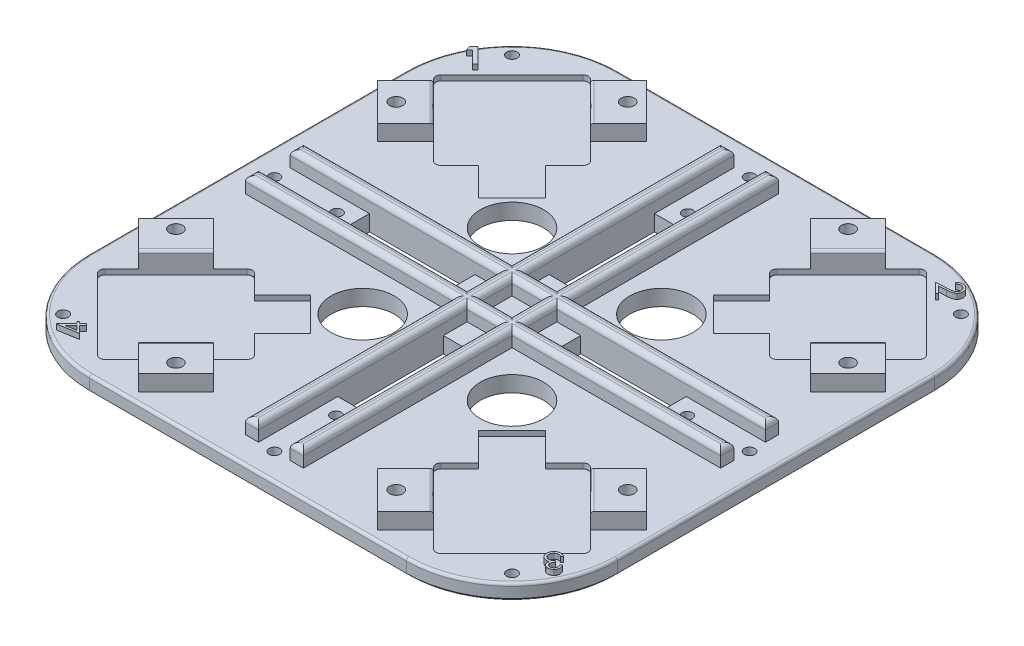
from build123d import *

# Parameters (mm, degrees)
SKETCH_1_W          = 200
SKETCH_1_H          = 200
SKETCH_1_R          = 2
EXTRUDE_1_DEPTH     = 6
CUT_EXTRUDE_1_DEPTH = 2
FILLET_1_R          = 2
EXTRUDE_3_DEPTH     = 6
FILLET_4_R          = 40
SKETCH_4_R          = 2.5
CUT_EXTRUDE_2_DEPTH = 8
SKETCH_5_W          = 5
SKETCH_5_H          = 180
EXTRUDE_4_DEPTH     = 6
SKETCH_6_W          = 180
SKETCH_6_H          = 5
EXTRUDE_5_DEPTH     = 6
FILLET_5_R          = 2
SKETCH_7_R          = 12
SKETCH_7_W          = 40
SKETCH_7_H          = 12
SKETCH_7_W_2        = 12
SKETCH_7_H_2        = 40
CUT_EXTRUDE_3_DEPTH = 6
CUT_EXTRUDE_4_DEPTH = 2
FILLET_6_R          = 1
SKETCH_9_R          = 2
CUT_EXTRUDE_5_DEPTH = 10
EXTRUDE_6_DEPTH     = 2
FILLET_9_R          = 1
CHAMFER_1_SIZE      = 1


with BuildPart() as part:
    # Эскиз1 → Бобышка-Вытянуть1 (new body)
    with BuildSketch(Plane(origin=(0, 0, 0), x_dir=(1, 0, 0), z_dir=(0, 1, 0))):
        Rectangle(SKETCH_1_W, SKETCH_1_H)
        with Locations(Location((-90, 0, 0), (0, 0, 270))):
            Circle(SKETCH_1_R, mode=Mode.SUBTRACT)
        with Locations(Location((0, 90, 0), (0, 0, 270))):
            Circle(SKETCH_1_R, mode=Mode.SUBTRACT)
        with Locations(Location((90, 0, 0), (0, 0, 270))):
            Circle(SKETCH_1_R, mode=Mode.SUBTRACT)
        with Locations(Location((0, -90, 0), (0, 0, 270))):
            Circle(SKETCH_1_R, mode=Mode.SUBTRACT)
        with Locations(Location((-85, 85, 0), (0, 0, 270))):
            Circle(SKETCH_1_R, mode=Mode.SUBTRACT)
        with Locations(Location((85, 85, 0), (0, 0, 270))):
            Circle(SKETCH_1_R, mode=Mode.SUBTRACT)
        with Locations(Location((85, -85, 0), (0, 0, 270))):
            Circle(SKETCH_1_R, mode=Mode.SUBTRACT)
        with Locations(Location((-85, -85, 0), (0, 0, 270))):
            Circle(SKETCH_1_R, mode=Mode.SUBTRACT)
    extrude(amount=EXTRUDE_1_DEPTH)

    # Эскиз2 → Вырез-Вытянуть1 (cut)
    with BuildSketch(Plane(origin=(0, 6, 0), x_dir=(1, 0, 0), z_dir=(0, 1, 0))):
        Polygon((63.639610307, 33.941125497), (33.941125497, 63.639610307), (63.639610307, 93.338095117), (93.338095117, 63.639610307), align=None)
        Polygon((33.941125497, -63.639610307), (63.639610307, -33.941125497), (93.338095117, -63.639610307), (63.639610307, -93.338095117), align=None)
        Polygon((-63.639610307, -33.941125497), (-33.941125497, -63.639610307), (-63.639610307, -93.338095117), (-93.338095117, -63.639610307), align=None)
        Polygon((-33.941125497, 63.639610307), (-63.639610307, 33.941125497), (-93.338095117, 63.639610307), (-63.639610307, 93.338095117), align=None)
    extrude(amount=-CUT_EXTRUDE_1_DEPTH, mode=Mode.SUBTRACT)

    # Скругление1
    fillet_1_edges = [part.edges().sort_by_distance(p)[0] for p in [
        (93.338095117, 5, -63.639610307),
        (63.639610307, 5, -33.941125497),
        (33.941125497, 5, -63.639610307),
        (63.639610307, 5, -93.338095117),
        (-93.338095117, 5, 63.639610307),
        (-63.639610307, 5, 33.941125497),
        (-33.941125497, 5, 63.639610307),
        (-63.639610307, 5, 93.338095117),
        (-63.639610307, 5, -93.338095117),
        (-33.941125497, 5, -63.639610307),
        (-63.639610307, 5, -33.941125497),
        (-93.338095117, 5, -63.639610307),
        (63.639610307, 5, 93.338095117),
        (33.941125497, 5, 63.639610307),
        (63.639610307, 5, 33.941125497),
        (93.338095117, 5, 63.639610307),
    ]]
    fillet(fillet_1_edges, radius=FILLET_1_R)

    # Эскиз3 → Бобышка-Вытянуть3 (add)
    with BuildSketch(Plane(origin=(0, 6, 0), x_dir=(1, 0, 0), z_dir=(0, 1, 0))):
        Polygon((41.71930009, 71.4177849), (55.861435714, 85.559920524), (45.254833996, 96.166522241), (31.112698372, 82.024386618), align=None)
        Polygon((85.559920524, 55.861435714), (96.166522241, 45.254833996), (82.024386618, 31.112698372), (71.4177849, 41.71930009), align=None)
        Polygon((71.4177849, -41.71930009), (85.559920524, -55.861435714), (96.166522241, -45.254833996), (82.024386618, -31.112698372), align=None)
        Polygon((31.112698372, -82.024386618), (45.254833996, -96.166522241), (55.861435714, -85.559920524), (41.71930009, -71.4177849), align=None)
        Polygon((-41.71930009, -71.4177849), (-55.861435714, -85.559920524), (-45.254833996, -96.166522241), (-31.112698372, -82.024386618), align=None)
        Polygon((-85.559920524, -55.861435714), (-96.166522241, -45.254833996), (-82.024386618, -31.112698372), (-71.4177849, -41.71930009), align=None)
        Polygon((-71.4177849, 41.71930009), (-85.559920524, 55.861435714), (-96.166522241, 45.254833996), (-82.024386618, 31.112698372), align=None)
        Polygon((-31.112698372, 82.024386618), (-45.254833996, 96.166522241), (-55.861435714, 85.559920524), (-41.71930009, 71.4177849), align=None)
    extrude(amount=EXTRUDE_3_DEPTH)

    # Скругление4
    fillet_4_edges = [part.edges().sort_by_distance(p)[0] for p in [
        (100, 3, 100),
        (-100, 3, 100),
        (-100, 3, -100),
        (100, 3, -100),
    ]]
    fillet(fillet_4_edges, radius=FILLET_4_R)

    # Эскиз4 → Вырез-Вытянуть2 (cut)
    with BuildSketch(Plane(origin=(0, 12, 0), x_dir=(1, 0, 0), z_dir=(0, 1, 0))):
        with Locations(Location((41.71930009, 85.559920524, 0), (0, 0, 270))):
            Circle(SKETCH_4_R)
        with Locations(Location((85.559920524, 41.71930009, 0), (0, 0, 90))):
            Circle(SKETCH_4_R)
        with Locations(Location((85.559920524, -41.71930009, 0), (0, 0, 270))):
            Circle(SKETCH_4_R)
        with Locations(Location((41.71930009, -85.559920524, 0), (0, 0, 90))):
            Circle(SKETCH_4_R)
        with Locations(Location((-41.71930009, -85.559920524, 0), (0, 0, 270))):
            Circle(SKETCH_4_R)
        with Locations(Location((-85.559920524, -41.71930009, 0), (0, 0, 90))):
            Circle(SKETCH_4_R)
        with Locations(Location((-85.559920524, 41.71930009, 0), (0, 0, 270))):
            Circle(SKETCH_4_R)
        with Locations(Location((-41.71930009, 85.559920524, 0), (0, 0, 90))):
            Circle(SKETCH_4_R)
    extrude(amount=-CUT_EXTRUDE_2_DEPTH, mode=Mode.SUBTRACT)

    # Эскиз5 → Бобышка-Вытянуть4 (add)
    with BuildSketch(Plane(origin=(0, 6, 0), x_dir=(1, 0, 0), z_dir=(0, 1, 0))):
        with Locations((-8.5, 0)):
            Rectangle(SKETCH_5_W, SKETCH_5_H)
        with Locations((8.5, 0)):
            Rectangle(SKETCH_5_W, SKETCH_5_H)
    extrude(amount=EXTRUDE_4_DEPTH)

    # Эскиз6 → Бобышка-Вытянуть5 (add)
    with BuildSketch(Plane(origin=(0, 6, 0), x_dir=(1, 0, 0), z_dir=(0, 1, 0))):
        with Locations((0, 8.5)):
            Rectangle(SKETCH_6_W, SKETCH_6_H)
        with Locations((0, -8.5)):
            Rectangle(SKETCH_6_W, SKETCH_6_H)
    extrude(amount=EXTRUDE_5_DEPTH)

    # Скругление5
    fillet_5_edges = [part.edges().sort_by_distance(p)[0] for p in [
        (11, 12, 50.5),
        (8.5, 12, -90),
        (6, 12, -50.5),
        (8.5, 12, 90),
        (-6, 12, 50.5),
        (-8.5, 12, -90),
        (-11, 12, -50.5),
        (-8.5, 12, 90),
        (-6, 12, -50.5),
        (-11, 12, 0),
        (11, 12, -50.5),
        (6, 12, 0),
        (50.5, 12, -6),
        (90, 12, -8.5),
        (50.5, 12, -11),
        (0, 12, -11),
        (0, 12, -6),
        (-50.5, 12, -11),
        (-90, 12, -8.5),
        (-50.5, 12, -6),
        (11, 12, 0),
        (-11, 12, 50.5),
        (-6, 12, 0),
        (6, 12, 50.5),
        (50.5, 12, 11),
        (90, 12, 8.5),
        (50.5, 12, 6),
        (0, 12, 6),
        (0, 12, 11),
        (-50.5, 12, 6),
        (-90, 12, 8.5),
        (-50.5, 12, 11),
    ]]
    fillet(fillet_5_edges, radius=FILLET_5_R)

    # Эскиз7 → Вырез-Вытянуть3 (cut)
    with BuildSketch(Plane(origin=(0, 6, 0), x_dir=(1, 0, 0), z_dir=(0, 1, 0))):
        with Locations(Location((28.284271247, 28.284271247, 0), (0, 0, 270))):
            Circle(SKETCH_7_R)
        with Locations(Location((28.284271247, -28.284271247, 0), (0, 0, 270))):
            Circle(SKETCH_7_R)
        with Locations(Location((-28.284271247, -28.284271247, 0), (0, 0, 270))):
            Circle(SKETCH_7_R)
        with Locations(Location((-28.284271247, 28.284271247, 0), (0, 0, 270))):
            Circle(SKETCH_7_R)
        with Locations((40, 0)):
            Rectangle(SKETCH_7_W, SKETCH_7_H)
        with Locations((0, 40)):
            Rectangle(SKETCH_7_W_2, SKETCH_7_H_2)
        with Locations((0, -40)):
            Rectangle(SKETCH_7_W_2, SKETCH_7_H_2)
        with Locations((-40, 0)):
            Rectangle(SKETCH_7_W, SKETCH_7_H)
    extrude(amount=-CUT_EXTRUDE_3_DEPTH, mode=Mode.SUBTRACT)

    # Эскиз8 → Вырез-Вытянуть4 (cut)
    with BuildSketch(Plane(origin=(0, 6, 0), x_dir=(1, 0, 0), z_dir=(0, 1, 0))):
        Polygon((44.547727215, 31.819805153), (31.819805153, 44.547727215), (53.033008589, 65.76093065), (65.76093065, 53.033008589), align=None)
        Polygon((65.76093065, -53.033008589), (53.033008589, -65.76093065), (31.819805153, -44.547727215), (44.547727215, -31.819805153), align=None)
        Polygon((-44.547727215, -31.819805153), (-31.819805153, -44.547727215), (-53.033008589, -65.76093065), (-65.76093065, -53.033008589), align=None)
        Polygon((-65.76093065, 53.033008589), (-53.033008589, 65.76093065), (-31.819805153, 44.547727215), (-44.547727215, 31.819805153), align=None)
    extrude(amount=-CUT_EXTRUDE_4_DEPTH, mode=Mode.SUBTRACT)

    # Скругление6
    fillet_6_edges = [part.edges().sort_by_distance(p)[0] for p in [
        (48.790367902, 12, -78.488852712),
        (78.488852712, 12, -48.790367902),
        (78.488852712, 12, 48.790367902),
        (48.790367902, 12, 78.488852712),
        (-48.790367902, 12, 78.488852712),
        (-78.488852712, 12, 48.790367902),
        (-78.488852712, 12, -48.790367902),
        (-48.790367902, 12, -78.488852712),
    ]]
    fillet(fillet_6_edges, radius=FILLET_6_R)

    # Эскиз9 → Вырез-Вытянуть5 (cut)
    with BuildSketch(Plane(origin=(0, 6, 0), x_dir=(1, 0, 0), z_dir=(0, 1, 0))):
        with Locations(Location((0.141931936, 66.467885895, 0), (0, 0, 270))):
            Circle(SKETCH_9_R)
        with Locations(Location((-0.141931936, -66.467885895, 0), (0, 0, 90))):
            Circle(SKETCH_9_R)
        with Locations(Location((66.467885895, -0.141931936, 0), (0, 0, 270))):
            Circle(SKETCH_9_R)
        with Locations(Location((-66.467885895, 0.141931936, 0), (0, 0, 90))):
            Circle(SKETCH_9_R)
    extrude(amount=-CUT_EXTRUDE_5_DEPTH, mode=Mode.SUBTRACT)

    # Эскиз10 → Бобышка-Вытянуть6 (add)
    # profile 1 of 4: a face of its own
    with BuildSketch(Plane(origin=(0, 6, 0), x_dir=(1, 0, 0), z_dir=(0, 1, 0))):
        Polygon((-93.750712904, 77.724103786), (-92.154559058, 79.320257633), (-86.555200084, 73.720898658), (-87.614494955, 72.661603786), (-92.212251366, 77.259360197), (-93.364494955, 76.107116607), align=None)
    # profile 2 of 4: a face of its own
    with BuildSketch(Plane(origin=(0, 6, 0), x_dir=(1, 0, 0), z_dir=(0, 1, 0))):
        with BuildLine():
            Line((76.0987496, 91.923727861), (75.555480369, 92.450971451))
            add(Edge.make_bspline(
                [(75.555480369, 92.450971451), (75.625456903, 92.516300702), (75.763171662, 92.644869547), (75.984477293, 92.813355888), (76.214418423, 92.955015815), (76.448941617, 93.07469718), (76.692130442, 93.166387315), (76.940996589, 93.234254207), (77.197732973, 93.276209775), (77.45859831, 93.291128509), (77.718971729, 93.284412395), (77.973089743, 93.249519834), (78.219528351, 93.19460855), (78.457011726, 93.111989621), (78.684788931, 93.003299851), (78.905866958, 92.873593769), (79.116948527, 92.717085838), (79.247247499, 92.596973846), (79.31349319, 92.535907348)],
                knots=[0, 0, 0, 0, 1.096707932, 2.158335985, 3.181104264, 4.188679101, 5.171089785, 6.15426324, 7.140633891, 8.146551945, 9.144952296, 10.120778538, 11.081683335, 12.034282701, 12.995557996, 13.969942767, 14.96789251, 16, 16, 16, 16], degree=3))
            add(Edge.make_bspline(
                [(79.31349319, 92.535907348), (79.376133617, 92.472382182), (79.498609197, 92.348176745), (79.658547196, 92.146504222), (79.790824979, 91.936920476), (79.904521546, 91.72360044), (79.986478784, 91.500269581), (80.048867911, 91.272157142), (80.084257123, 91.036558632), (80.092093621, 90.797626194), (80.082312183, 90.559888758), (80.047756573, 90.328865814), (79.995235457, 90.105968697), (79.921344241, 89.892191894), (79.826349966, 89.687563372), (79.710121516, 89.492869607), (79.5733703, 89.306937789), (79.467949379, 89.193054903), (79.414454728, 89.135266323)],
                knots=[0, 0, 0, 0, 1.126407395, 2.20237005, 3.243119692, 4.254155062, 5.249257611, 6.241152066, 7.237443563, 8.250413586, 9.256935383, 10.238887691, 11.196329578, 12.145940279, 13.090864483, 14.040954544, 15.005904593, 16, 16, 16, 16], degree=3))
            add(Edge.make_bspline(
                [(79.414454728, 89.135266323), (79.334585842, 89.058818614), (79.176248186, 88.907263341), (78.906415115, 88.719180831), (78.615917628, 88.565381577), (78.353842131, 88.467984262), (78.125691711, 88.404103173), (77.930771586, 88.361796151), (77.713080246, 88.323633899), (77.47308599, 88.288735255), (77.210164554, 88.257002101), (76.924386141, 88.2279042), (76.61605709, 88.204120186), (76.402728992, 88.192528989), (76.292659857, 88.186548374)],
                knots=[0, 0, 0, 0, 1.187168596, 2.353525883, 3.522425488, 4.712854112, 5.351061531, 6.068672607, 6.856146978, 7.726827361, 8.675672764, 9.70315713, 10.814916963, 12, 12, 12, 12], degree=3))
            Line((76.292659857, 88.186548374), (73.401634216, 88.035907348))
            Line((73.401634216, 88.035907348), (76.020223959, 85.489432989))
            Line((76.020223959, 85.489432989), (75.486570113, 84.941356066))
            Line((75.486570113, 84.941356066), (71.63400601, 88.688150938))
            Line((71.63400601, 88.688150938), (76.077916267, 88.922125297))
            add(Edge.make_bspline(
                [(76.077916267, 88.922125297), (76.185832846, 88.927808916), (76.393177431, 88.938729089), (76.691346693, 88.957508236), (76.964393647, 88.979706639), (77.211700451, 89.005468084), (77.433612602, 89.031997376), (77.62982603, 89.062218849), (77.800375067, 89.095416355), (77.992607262, 89.141452681), (78.208401553, 89.215326902), (78.444591375, 89.335219659), (78.663280187, 89.480628968), (78.788950071, 89.600706446), (78.851954728, 89.660907348)],
                knots=[0, 0, 0, 0, 1.321538564, 2.53912669, 3.653426717, 4.67135875, 5.579670898, 6.386254171, 7.09857628, 7.703820083, 8.802888551, 9.877991162, 10.936129829, 12, 12, 12, 12], degree=3))
            add(Edge.make_bspline(
                [(78.851954728, 89.660907348), (78.889138988, 89.701322038), (78.962090456, 89.780611259), (79.055799803, 89.910822514), (79.135318047, 90.047245104), (79.197039806, 90.191973943), (79.24570762, 90.34208732), (79.279824463, 90.498739105), (79.297163239, 90.662597596), (79.297995176, 90.831000903), (79.286084134, 91.000079946), (79.256992079, 91.164749987), (79.213640868, 91.323825712), (79.153811421, 91.476784477), (79.078739122, 91.623958095), (78.987516562, 91.764716311), (78.882126488, 91.900201752), (78.800486994, 91.982747798), (78.75900601, 92.0246894)],
                knots=[0, 0, 0, 0, 1.001176195, 1.964198688, 2.920391499, 3.876335942, 4.8286967, 5.795950982, 6.795798097, 7.828910882, 8.864915681, 9.883958, 10.874643394, 11.868248699, 12.875101078, 13.883461709, 14.924588032, 16, 16, 16, 16], degree=3))
            add(Edge.make_bspline(
                [(78.75900601, 92.0246894), (78.713819384, 92.066700287), (78.624711788, 92.149545356), (78.480125402, 92.256764299), (78.329782516, 92.347211025), (78.174710581, 92.422055278), (78.012581339, 92.475445096), (77.847303897, 92.516822784), (77.675820063, 92.539001355), (77.500266858, 92.543604068), (77.322031103, 92.530759223), (77.143930156, 92.499949054), (76.966131774, 92.452436274), (76.791051228, 92.381690321), (76.615898173, 92.294825393), (76.440783213, 92.190482172), (76.266841312, 92.066341532), (76.155772727, 91.972107864), (76.0987496, 91.923727861)],
                knots=[0, 0, 0, 0, 0.999236725, 1.970485302, 2.910207686, 3.839506206, 4.753806862, 5.671298233, 6.596839711, 7.549392204, 8.512739281, 9.487568758, 10.474544446, 11.488852904, 12.541836524, 13.640408778, 14.788574904, 16, 16, 16, 16], degree=3))
        make_face()
    # profile 3 of 4: a face of its own
    with BuildSketch(Plane(origin=(0, 6, 0), x_dir=(1, 0, 0), z_dir=(0, 1, 0))):
        with BuildLine():
            Line((93.30565469, -75.269836506), (93.877770075, -74.697721121))
            add(Edge.make_bspline(
                [(93.877770075, -74.697721121), (93.920645041, -74.767558836), (94.004664798, -74.904416036), (94.107822293, -75.11725914), (94.1949115, -75.32742911), (94.265239933, -75.535776385), (94.312833646, -75.744241639), (94.344063302, -75.951004858), (94.355374267, -76.157590278), (94.34719146, -76.361939646), (94.321367404, -76.562370513), (94.280010607, -76.756579463), (94.221724501, -76.94436212), (94.146936247, -77.125638568), (94.052498802, -77.298778174), (93.945061559, -77.466847379), (93.819733126, -77.628048751), (93.724313251, -77.727390865), (93.675846998, -77.777849326)],
                knots=[0, 0, 0, 0, 1.170484256, 2.293734846, 3.375435631, 4.420749686, 5.431828265, 6.427251425, 7.405876103, 8.38378589, 9.345833706, 10.290643946, 11.217864792, 12.152161134, 13.088015625, 14.032455689, 15.000632703, 16, 16, 16, 16], degree=3))
            add(Edge.make_bspline(
                [(93.675846998, -77.777849326), (93.601535085, -77.846988068), (93.45414002, -77.984122332), (93.206704404, -78.156730977), (92.940544386, -78.294478547), (92.661600856, -78.400516481), (92.375500629, -78.468684985), (92.090229276, -78.502695308), (91.807956158, -78.494270634), (91.533523666, -78.447135283), (91.271638438, -78.368684279), (91.030511062, -78.255980569), (90.808522178, -78.117550284), (90.681632808, -78.000077973), (90.61815469, -77.941310865)],
                knots=[0, 0, 0, 0, 1.075044312, 2.132312603, 3.185980573, 4.245112561, 5.287597427, 6.296297766, 7.282037936, 8.269793007, 9.240701039, 10.170544897, 11.084790413, 12, 12, 12, 12], degree=3))
            add(Edge.make_bspline(
                [(90.61815469, -77.941310865), (90.561278218, -77.88032619), (90.449653059, -77.760638316), (90.316078324, -77.557440761), (90.21323779, -77.341971825), (90.144342686, -77.112737199), (90.107895009, -76.870561865), (90.101453409, -76.615884402), (90.129713657, -76.34805419), (90.170723821, -76.168514386), (90.191872639, -76.075926249)],
                knots=[0, 0, 0, 0, 0.993781949, 1.950385902, 2.888628214, 3.834528718, 4.795710561, 5.803342807, 6.867190488, 8, 8, 8, 8], degree=3))
            add(Edge.make_bspline(
                [(90.191872639, -76.075926249), (90.098098538, -76.112069415), (89.913264863, -76.183309491), (89.625751014, -76.245925647), (89.337621884, -76.276170009), (89.146490351, -76.264472207), (89.050846998, -76.258618557)],
                knots=[0, 0, 0, 0, 1.031972638, 2.034072241, 3.016238085, 4, 4, 4, 4], degree=3))
            add(Edge.make_bspline(
                [(89.050846998, -76.258618557), (88.984439849, -76.250608361), (88.853404407, -76.23480254), (88.661848133, -76.192779835), (88.478963314, -76.135296567), (88.30492356, -76.061837358), (88.137160509, -75.977568369), (87.978079546, -75.876346218), (87.828666887, -75.758274102), (87.735608653, -75.671154057), (87.68866751, -75.627208301)],
                knots=[0, 0, 0, 0, 1.047190234, 2.06632926, 3.066575408, 4.045493254, 5.022120058, 6.003929838, 6.993127092, 8, 8, 8, 8], degree=3))
            add(Edge.make_bspline(
                [(87.68866751, -75.627208301), (87.613084564, -75.545287399), (87.462651629, -75.382240014), (87.279062176, -75.101888177), (87.132503652, -74.796759731), (87.024786826, -74.469766027), (86.956544763, -74.131321901), (86.937483313, -73.788803449), (86.964281452, -73.448312363), (87.041139391, -73.112307774), (87.160976841, -72.784917225), (87.326357551, -72.472636592), (87.532422845, -72.175790609), (87.698610547, -71.998114272), (87.783218792, -71.907657019)],
                knots=[0, 0, 0, 0, 0.966808184, 1.924240847, 2.897529409, 3.899665216, 4.906986366, 5.887580024, 6.869764087, 7.863713863, 8.872188434, 9.889155551, 10.925342594, 12, 12, 12, 12], degree=3))
            add(Edge.make_bspline(
                [(87.783218792, -71.907657019), (87.843241293, -71.850057468), (87.961434668, -71.736635249), (88.151133612, -71.585797901), (88.346878478, -71.455600484), (88.547876356, -71.345899132), (88.753860949, -71.257287168), (88.965203211, -71.189122958), (89.182775204, -71.1432814), (89.405252948, -71.115045279), (89.631755049, -71.111300899), (89.860552105, -71.126287848), (90.091059548, -71.167825607), (90.323312459, -71.230198656), (90.557621624, -71.31610797), (90.792053374, -71.425852266), (91.030013235, -71.555866445), (91.183532756, -71.65805448), (91.262385459, -71.710541634)],
                knots=[0, 0, 0, 0, 1.041937787, 2.051732953, 3.031922764, 3.984387595, 4.916887376, 5.837686935, 6.76191032, 7.699226157, 8.643209976, 9.596027524, 10.567701668, 11.572738343, 12.606084017, 13.690188495, 14.813604435, 16, 16, 16, 16], degree=3))
            Line((91.262385459, -71.710541634), (90.714308536, -72.258618557))
            add(Edge.make_bspline(
                [(90.714308536, -72.258618557), (90.657969783, -72.227097959), (90.548665541, -72.165944048), (90.384521481, -72.085593514), (90.226111695, -72.017361636), (90.072093054, -71.964803975), (89.923938931, -71.924021299), (89.781530696, -71.896266583), (89.644061028, -71.882652633), (89.554607572, -71.884376548), (89.510782895, -71.885221121)],
                knots=[0, 0, 0, 0, 1.213155082, 2.353672892, 3.433396787, 4.452607294, 5.409796838, 6.319524651, 7.176708282, 8, 8, 8, 8], degree=3))
            add(Edge.make_bspline(
                [(89.510782895, -71.885221121), (89.456700835, -71.890088595), (89.349376312, -71.899747977), (89.190139181, -71.932220647), (89.035405135, -71.982382511), (88.884138058, -72.046703377), (88.73627496, -72.126123289), (88.593204094, -72.2225058), (88.45229318, -72.333452753), (88.364792109, -72.41756105), (88.320077767, -72.460541634)],
                knots=[0, 0, 0, 0, 0.962766236, 1.910586011, 2.875588208, 3.843656419, 4.823067946, 5.848086802, 6.900340504, 8, 8, 8, 8], degree=3))
            add(Edge.make_bspline(
                [(88.320077767, -72.460541634), (88.271528317, -72.510943161), (88.176465124, -72.609632847), (88.05368577, -72.769670416), (87.946280729, -72.931539013), (87.859652676, -73.098765878), (87.791728414, -73.269417336), (87.742935299, -73.443976116), (87.714531353, -73.623031051), (87.703338822, -73.803912308), (87.709848473, -73.982579654), (87.732033941, -74.155452901), (87.770858124, -74.320580526), (87.823334684, -74.478865506), (87.892971946, -74.628370588), (87.977122639, -74.770640777), (88.076147021, -74.906270207), (88.154060395, -74.988070679), (88.193475203, -75.02945189)],
                knots=[0, 0, 0, 0, 1.168791581, 2.288575014, 3.365798014, 4.41205067, 5.430035609, 6.430804139, 7.43479346, 8.454538774, 9.455147984, 10.418620705, 11.362872177, 12.286122482, 13.200915751, 14.113527927, 15.045671748, 16, 16, 16, 16], degree=3))
            add(Edge.make_bspline(
                [(88.193475203, -75.02945189), (88.249750094, -75.080913063), (88.361776612, -75.183356903), (88.555316051, -75.305390348), (88.765769978, -75.399372381), (88.991016806, -75.462263901), (89.223759784, -75.49673319), (89.45846742, -75.496145318), (89.69113039, -75.464356769), (89.882624169, -75.408492324), (90.038415416, -75.345247153), (90.161737933, -75.279823124), (90.295003632, -75.204811579), (90.432951957, -75.112660569), (90.580184497, -75.00839308), (90.732068397, -74.887779434), (90.89425474, -74.756336717), (91.001555615, -74.660785078), (91.057257254, -74.61118266)],
                knots=[0, 0, 0, 0, 1.125552819, 2.240639813, 3.364834257, 4.522294529, 5.687166919, 6.832275972, 7.980403808, 9.147629586, 9.770916503, 10.463181741, 11.209591851, 12.03098738, 12.91414467, 13.87622299, 14.897512628, 16, 16, 16, 16], degree=3))
            Line((91.057257254, -74.61118266), (91.570077767, -75.124003173))
            add(Edge.make_bspline(
                [(91.570077767, -75.124003173), (91.508971182, -75.18859658), (91.389384776, -75.315006745), (91.234019868, -75.521132382), (91.104050819, -75.735110307), (91.001699872, -75.95514115), (90.929018392, -76.172636009), (90.881360919, -76.380310098), (90.8678137, -76.577175661), (90.884934554, -76.761294403), (90.931435726, -76.931971045), (90.998451302, -77.089992678), (91.088956407, -77.23551746), (91.165884189, -77.319044477), (91.204693151, -77.36118266)],
                knots=[0, 0, 0, 0, 1.268198691, 2.481881854, 3.675575391, 4.835262572, 5.936995727, 6.943337667, 7.867805264, 8.740930294, 9.569379222, 10.382212006, 11.183849153, 12, 12, 12, 12], degree=3))
            add(Edge.make_bspline(
                [(91.204693151, -77.36118266), (91.235626787, -77.390183788), (91.296985797, -77.447709535), (91.398270075, -77.521011244), (91.504803703, -77.5830817), (91.61816941, -77.630844699), (91.737122006, -77.668441803), (91.862552836, -77.691566998), (91.993350041, -77.704968351), (92.128607258, -77.70450879), (92.265437087, -77.691962505), (92.400187923, -77.66637509), (92.531907421, -77.627620226), (92.6591038, -77.574310252), (92.78412866, -77.509985642), (92.904586116, -77.431263697), (93.019874028, -77.337071378), (93.093447046, -77.268138728), (93.130975203, -77.232977532)],
                knots=[0, 0, 0, 0, 0.946328809, 1.877108781, 2.785830139, 3.694551497, 4.619192705, 5.566949708, 6.538151959, 7.552380118, 8.58297066, 9.603286973, 10.611319595, 11.643911352, 12.679257059, 13.748229027, 14.851415671, 16, 16, 16, 16], degree=3))
            add(Edge.make_bspline(
                [(93.130975203, -77.232977532), (93.186968737, -77.172123112), (93.296338725, -77.053258547), (93.42314384, -76.850258259), (93.509190596, -76.633391623), (93.549324797, -76.443008875), (93.563073168, -76.284426819), (93.5581101, -76.157926206), (93.546475341, -76.024831491), (93.519288807, -75.886005759), (93.484430246, -75.74009108), (93.43585935, -75.588897111), (93.376074409, -75.430747711), (93.329645743, -75.324656793), (93.30565469, -75.269836506)],
                knots=[0, 0, 0, 0, 1.401547454, 2.737588008, 4.035829474, 5.343002125, 6.025256469, 6.732773753, 7.488885258, 8.291009986, 9.131136297, 10.034504894, 10.984371067, 12, 12, 12, 12], degree=3))
        make_face()
    # profile 4 of 4: a face of its own
    with BuildSketch(Plane(origin=(0, 6, 0), x_dir=(1, 0, 0), z_dir=(0, 1, 0))):
        Polygon((-81.111471963, -91.488311314), (-81.225254015, -91.374529262), (-77.323010425, -87.472285673), (-78.00089504, -86.794401057), (-77.464036066, -86.257542083), (-76.786151451, -86.935426698), (-75.484869399, -85.634144647), (-74.925574527, -86.193439519), (-76.226856579, -87.49472157), (-73.552177092, -90.169401057), align=None)
        Polygon((-76.763715553, -88.031580544), (-79.097048886, -90.364913878), (-75.116279656, -89.679016442), align=None, mode=Mode.SUBTRACT)
    extrude(amount=EXTRUDE_6_DEPTH)

    # Скругление9
    fillet_9_edges = [part.edges().sort_by_distance(p)[0] for p in [
        (0, 6, -100),
        (100, 6, 0),
        (-100, 6, 0),
        (0, 6, 100),
        (-88.284271247, 6, -88.284271247),
        (-88.284271247, 6, 88.284271247),
        (88.284271247, 6, 88.284271247),
        (88.284271247, 6, -88.284271247),
    ]]
    fillet(fillet_9_edges, radius=FILLET_9_R)

    # Фаска1
    chamfer_1_edges = [part.edges().sort_by_distance(p)[0] for p in [
        (0, 0, -100),
        (100, 0, 0),
        (0, 0, 100),
        (-100, 0, 0),
        (-88.284271247, 0, -88.284271247),
        (-88.284271247, 0, 88.284271247),
        (88.284271247, 0, 88.284271247),
        (88.284271247, 0, -88.284271247),
    ]]
    chamfer(chamfer_1_edges, length=CHAMFER_1_SIZE)


solid = part.part
